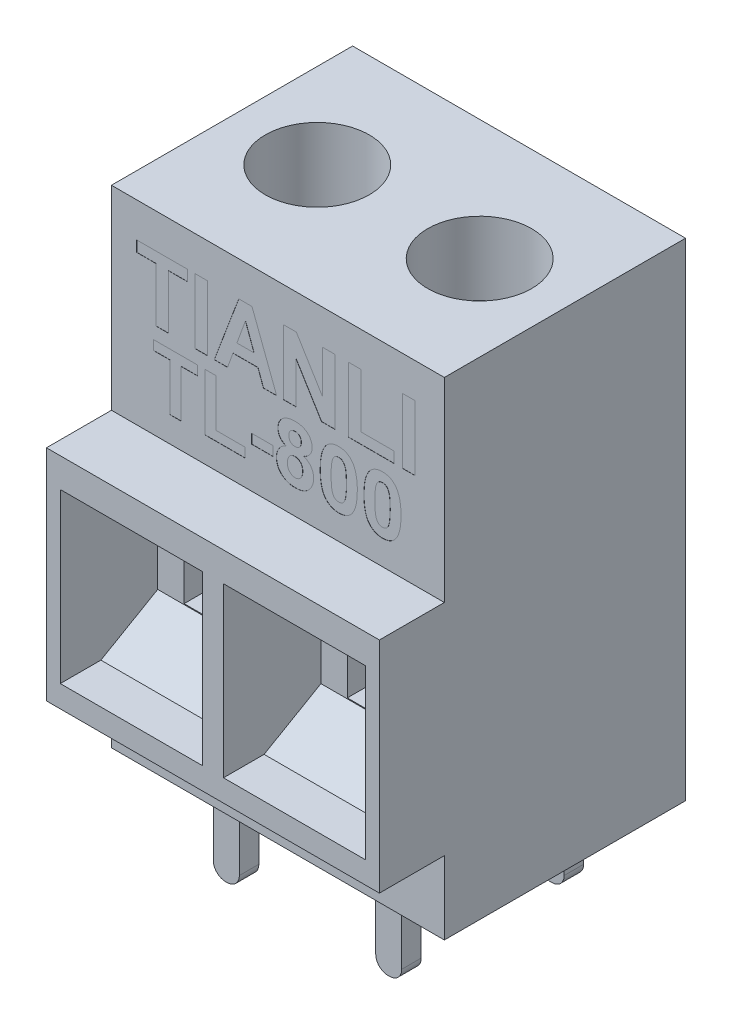
from build123d import *
from OCP.BRepFilletAPI import BRepFilletAPI_MakeChamfer

# Parameters (mm, degrees)
BOSS_EXTRUDE1_DEPTH     = 10.25
SKETCH2_W               = 8.75
SKETCH2_H               = 10.35
CUT_EXTRUDE1_DEPTH      = 6
SKETCH4_W               = 5.5
SKETCH4_H               = 6.2
CUT_EXTRUDE2_DEPTH      = 6
CHAMFER1_SIZE           = 3.5
CHAMFER1_SIZE2          = 2.020725942
SKETCH5_R               = 3.2
CUT_EXTRUDE3_DEPTH      = 4.5
SKETCH6_W               = 4.444559532
SKETCH6_H               = 1
SKETCH6_W_2             = 1
SKETCH6_H_2             = 3.5
CUT_EXTRUDE_THIN1_DEPTH = 1.5
SKETCH7_W               = 1.6
SKETCH7_H               = 1.2
BOSS_EXTRUDE2_DEPTH     = 5.45
FILLET1_R               = 0.75
SKETCH8_W               = 0.76923077
SKETCH8_H               = 4
SKETCH8_W_2             = 0.769230769
SKETCH8_W_3             = 1.301282051
SKETCH8_H_2             = 0.583333333
CUT_EXTRUDE4_DEPTH      = 0.01


with BuildPart() as part:
    # Sketch1 → Boss-Extrude1 (new, symmetric)
    with BuildSketch(Plane(origin=(0, 0, 0), x_dir=(0, 0, -1), z_dir=(1, 0, 0))):
        Polygon((7.425, 15), (-7.425, 15), (-7.425, 3), (-11.425, 3), (-11.425, -10.5), (-7.425, -10.5), (-7.425, -15), (7.425, -15), align=None)
    extrude(amount=BOSS_EXTRUDE1_DEPTH, both=True)

    # Sketch2 → Cut-Extrude1 (cut)
    with BuildSketch(Plane.XY.offset(11.425)):
        with Locations((5.025, -3.975)):
            Rectangle(SKETCH2_W, SKETCH2_H)
        with Locations((-5.025, -3.975)):
            Rectangle(SKETCH2_W, SKETCH2_H)
    extrude(amount=-CUT_EXTRUDE1_DEPTH, mode=Mode.SUBTRACT)

    # Sketch4 → Cut-Extrude2 (cut)
    with BuildSketch(Plane.XY.offset(5.425)):
        with Locations((-5.025, -3.975)):
            Rectangle(SKETCH4_W, SKETCH4_H)
        with Locations((5.025, -3.975)):
            Rectangle(SKETCH4_W, SKETCH4_H)
    extrude(amount=-CUT_EXTRUDE2_DEPTH, mode=Mode.SUBTRACT)

    # Chamfer1: one chamfer whose edges measure the first distance from different faces: ONE call of the kernel's chamfer builder (chamfer() names one face for all edges)
    chamfer1_edges_1 = [part.edges().sort_by_distance(p)[0] for p in [
        (-5.025, -9.15, 5.425),
    ]]
    chamfer1_side_1 = [part.faces().sort_by_distance(p)[0] for p in [
        (-5.025, -9.15, 8.425),
    ]]
    chamfer1_edges_2 = [part.edges().sort_by_distance(p)[0] for p in [
        (-5.025, 1.2, 5.425),
    ]]
    chamfer1_side_2 = [part.faces().sort_by_distance(p)[0] for p in [
        (-5.025, 1.2, 8.425),
    ]]
    chamfer1_edges_3 = [part.edges().sort_by_distance(p)[0] for p in [
        (5.025, -9.15, 5.425),
    ]]
    chamfer1_side_3 = [part.faces().sort_by_distance(p)[0] for p in [
        (5.025, -9.15, 8.425),
    ]]
    chamfer1_edges_4 = [part.edges().sort_by_distance(p)[0] for p in [
        (5.025, 1.2, 5.425),
    ]]
    chamfer1_side_4 = [part.faces().sort_by_distance(p)[0] for p in [
        (5.025, 1.2, 8.425),
    ]]
    chamfer1 = BRepFilletAPI_MakeChamfer(part.part.solid().wrapped)
    for e in chamfer1_edges_1:
        chamfer1.Add(CHAMFER1_SIZE, CHAMFER1_SIZE2, e.wrapped, chamfer1_side_1[0].wrapped)  # the first distance lies on this face
    for e in chamfer1_edges_2:
        chamfer1.Add(CHAMFER1_SIZE, CHAMFER1_SIZE2, e.wrapped, chamfer1_side_2[0].wrapped)  # the first distance lies on this face
    for e in chamfer1_edges_3:
        chamfer1.Add(CHAMFER1_SIZE, CHAMFER1_SIZE2, e.wrapped, chamfer1_side_3[0].wrapped)  # the first distance lies on this face
    for e in chamfer1_edges_4:
        chamfer1.Add(CHAMFER1_SIZE, CHAMFER1_SIZE2, e.wrapped, chamfer1_side_4[0].wrapped)  # the first distance lies on this face
    add(Compound.cast(chamfer1.Shape()), mode=Mode.REPLACE)

    # Sketch5 → Cut-Extrude3 (cut)
    with BuildSketch(Plane(origin=(0, 15, 0), x_dir=(1, 0, 0), z_dir=(0, 1, 0))):
        with Locations(Location((-5, 0, 0), (0, 0, 270))):
            Circle(SKETCH5_R)
        with Locations(Location((5, 0, 0), (0, 0, 90))):
            Circle(SKETCH5_R)
    extrude(amount=-CUT_EXTRUDE3_DEPTH, mode=Mode.SUBTRACT)

    # Sketch6 → Cut-Extrude-Thin1 (cut)
    with BuildSketch(Plane(origin=(0, 10.5, 0), x_dir=(1, 0, 0), z_dir=(0, 1, 0))):
        with Locations((-5, 0)):
            Rectangle(SKETCH6_W, SKETCH6_H)
        with Locations((-5, 0)):
            Rectangle(SKETCH6_W_2, SKETCH6_H_2)
        with Locations((5, 0)):
            Rectangle(SKETCH6_W_2, SKETCH6_H_2)
        with Locations((5, 0)):
            Rectangle(SKETCH6_W, SKETCH6_H)
    extrude(amount=-CUT_EXTRUDE_THIN1_DEPTH, mode=Mode.SUBTRACT)

    # Sketch7 → Boss-Extrude2 (add)
    with BuildSketch(Plane.XZ.offset(15)):
        with Locations((-5, 5)):
            Rectangle(SKETCH7_W, SKETCH7_H)
        with Locations((5, 5)):
            Rectangle(SKETCH7_W, SKETCH7_H)
        with Locations((-5, -5)):
            Rectangle(SKETCH7_W, SKETCH7_H)
        with Locations((5, -5)):
            Rectangle(SKETCH7_W, SKETCH7_H)
    extrude(amount=BOSS_EXTRUDE2_DEPTH)

    # Fillet1
    fillet1_edges = [part.edges().sort_by_distance(p)[0] for p in [
        (-4.2, -20.45, 5),
        (-5.8, -20.45, 5),
        (5.8, -20.45, 5),
        (4.2, -20.45, 5),
        (-4.2, -20.45, -5),
        (-5.8, -20.45, -5),
        (4.2, -20.45, -5),
        (5.8, -20.45, -5),
    ]]
    fillet(fillet1_edges, radius=FILLET1_R)

    # Sketch8 → Cut-Extrude4 (cut)
    # profile 1 of 12: a face of its own
    with BuildSketch(Plane.XY.offset(7.425)):
        Polygon((-7.512820513, 8.861293986), (-7.512820513, 12.194627319), (-8.692307692, 12.194627319), (-8.692307692, 12.861293986), (-5.564102564, 12.861293986), (-5.564102564, 12.194627319), (-6.743589744, 12.194627319), (-6.743589744, 8.861293986), align=None)
    # profile 2 of 12: a face of its own
    with BuildSketch(Plane.XY.offset(7.425)):
        with Locations((-4.717948718, 10.861293986)):
            Rectangle(SKETCH8_W, SKETCH8_H)
    # profile 3 of 12: a face of its own
    with BuildSketch(Plane.XY.offset(7.425)):
        Polygon((-0.076923077, 8.861293986), (-0.892628205, 8.861293986), (-1.229967949, 9.784370909), (-2.765224359, 9.784370909), (-3.102564103, 8.861293986), (-3.923076923, 8.861293986), (-2.411057692, 12.861293986), (-1.596153846, 12.861293986), align=None)
        Polygon((-1.474358974, 10.451037576), (-2, 11.886935012), (-2.524038462, 10.451037576), align=None, mode=Mode.SUBTRACT)
    # profile 4 of 12: a face of its own
    with BuildSketch(Plane.XY.offset(7.425)):
        Polygon((0.333333333, 8.861293986), (0.333333333, 12.861293986), (1.137019231, 12.861293986), (2.743589744, 10.231486294), (2.743589744, 12.861293986), (3.512820513, 12.861293986), (3.512820513, 8.861293986), (2.684294872, 8.861293986), (1.102564103, 11.449435012), (1.102564103, 8.861293986), align=None)
    # profile 5 of 12: a face of its own
    with BuildSketch(Plane.XY.offset(7.425)):
        Polygon((4.333333333, 8.861293986), (4.333333333, 12.861293986), (5.102564103, 12.861293986), (5.102564103, 9.527960653), (7.153846154, 9.527960653), (7.153846154, 8.861293986), align=None)
    # profile 6 of 12: a face of its own
    with BuildSketch(Plane.XY.offset(7.425)):
        with Locations((8.051282052, 10.861293986)):
            Rectangle(SKETCH8_W_2, SKETCH8_H)
    # profile 7 of 12: a face of its own
    with BuildSketch(Plane.XY.offset(7.425)):
        Polygon((-6.641025641, 4.564745346), (-6.641025641, 7.481412013), (-7.673076923, 7.481412013), (-7.673076923, 8.064745346), (-4.935897436, 8.064745346), (-4.935897436, 7.481412013), (-5.967948718, 7.481412013), (-5.967948718, 4.564745346), align=None)
    # profile 8 of 12: a face of its own
    with BuildSketch(Plane.XY.offset(7.425)):
        Polygon((-4.487179487, 4.564745346), (-4.487179487, 8.064745346), (-3.814102564, 8.064745346), (-3.814102564, 5.14807868), (-2.019230769, 5.14807868), (-2.019230769, 4.564745346), align=None)
    # profile 9 of 12: a face of its own
    with BuildSketch(Plane.XY.offset(7.425)):
        with Locations((-0.96474359, 5.798719705)):
            Rectangle(SKETCH8_W_3, SKETCH8_H_2)
    # profile 10 of 12: a face of its own
    with BuildSketch(Plane.XY.offset(7.425)):
        with BuildLine():
            add(Edge.make_bspline(
                [(0.505508814, 6.467589898), (0.484108403, 6.476651492), (0.442102019, 6.494438289), (0.382460985, 6.525535645), (0.327170175, 6.558701255), (0.277098211, 6.59525645), (0.230170324, 6.632557978), (0.189165573, 6.674408494), (0.151660805, 6.717636029), (0.108878396, 6.778603764), (0.065235353, 6.859081875), (0.027728374, 6.961355467), (0.004414915, 7.068340181), (0.001484224, 7.141484222), (0, 7.178527398)],
                knots=[0, 0, 0, 0, 0.898135024, 1.762928937, 2.598141881, 3.387992021, 4.158483993, 4.912374357, 5.649344587, 6.368826796, 7.78793972, 9.174346042, 10.568971657, 12, 12, 12, 12], degree=3))
            add(Edge.make_bspline(
                [(0, 7.178527398), (0.000794324, 7.209883646), (0.002354104, 7.271456563), (0.015052406, 7.361780572), (0.037092733, 7.447908544), (0.067024117, 7.530084069), (0.105968392, 7.607868176), (0.153525204, 7.681185276), (0.208814476, 7.751060563), (0.273687797, 7.8152257), (0.345689766, 7.874508393), (0.425821831, 7.925594708), (0.513225967, 7.968513765), (0.607403672, 8.004630911), (0.709306049, 8.031323985), (0.818012205, 8.051268479), (0.93390967, 8.062075882), (1.013567998, 8.063839437), (1.054487179, 8.064745346)],
                knots=[0, 0, 0, 0, 0.969401132, 1.903571386, 2.813295953, 3.714164367, 4.602979607, 5.497068024, 6.412430398, 7.352730811, 8.313282239, 9.291613189, 10.283859467, 11.320059661, 12.405231593, 13.536450991, 14.734515125, 16, 16, 16, 16], degree=3))
            add(Edge.make_bspline(
                [(1.054487179, 8.064745346), (1.095175168, 8.063857122), (1.174139354, 8.062133324), (1.289304373, 8.051112407), (1.397154582, 8.031549594), (1.498481383, 8.004401323), (1.592361957, 7.968310955), (1.680140287, 7.926034105), (1.759924081, 7.874050908), (1.832494647, 7.815292758), (1.898034509, 7.75106985), (1.953981151, 7.681183548), (2.002393932, 7.60807055), (2.041194259, 7.530057944), (2.071253709, 7.447924084), (2.092986737, 7.361711699), (2.106863059, 7.271525634), (2.108262218, 7.209895664), (2.108974359, 7.178527398)],
                knots=[0, 0, 0, 0, 1.259437241, 2.444221022, 3.576496957, 4.648717845, 5.68588583, 6.685544666, 7.658705287, 8.625770615, 9.572078176, 10.492824823, 11.391686538, 12.281331915, 13.183041723, 14.093615956, 15.029693465, 16, 16, 16, 16], degree=3))
            add(Edge.make_bspline(
                [(2.108974359, 7.178527398), (2.107438833, 7.139582302), (2.104417221, 7.062946027), (2.07806347, 6.951824743), (2.036587193, 6.846867631), (1.977022876, 6.750332445), (1.903280867, 6.661923124), (1.814179219, 6.585333091), (1.712646687, 6.518269782), (1.637210264, 6.484759896), (1.598557692, 6.467589898)],
                knots=[0, 0, 0, 0, 1.001685467, 1.971119642, 2.924446479, 3.896772127, 4.879289176, 5.877460772, 6.912440485, 8, 8, 8, 8], degree=3))
            add(Edge.make_bspline(
                [(1.598557692, 6.467589898), (1.622551724, 6.457652114), (1.6696341, 6.438151662), (1.736541113, 6.403444108), (1.798855918, 6.365426657), (1.857675401, 6.32511941), (1.910743328, 6.279790233), (1.960004265, 6.232087998), (2.005463682, 6.181348936), (2.045678623, 6.126899753), (2.081666206, 6.069663528), (2.11324535, 6.01054457), (2.139276996, 5.948680689), (2.160948834, 5.885225403), (2.178087393, 5.819398926), (2.189509769, 5.751339299), (2.197945057, 5.681140544), (2.198458268, 5.633514977), (2.198717949, 5.609416821)],
                knots=[0, 0, 0, 0, 1.114643742, 2.187213659, 3.231772812, 4.247796845, 5.244764516, 6.224002375, 7.19061506, 8.165938012, 9.126385546, 10.091434554, 11.040068535, 12.004700134, 12.968444139, 13.956586669, 14.966049226, 16, 16, 16, 16], degree=3))
            add(Edge.make_bspline(
                [(2.198717949, 5.609416821), (2.197719664, 5.570118436), (2.195758173, 5.492902529), (2.181998389, 5.37983852), (2.157145773, 5.272647891), (2.12323776, 5.171061405), (2.080955843, 5.074351961), (2.026830988, 4.984390815), (1.964224565, 4.89956236), (1.892143942, 4.821455091), (1.812332422, 4.750691643), (1.725834459, 4.688503658), (1.63249613, 4.636576264), (1.533084848, 4.593266483), (1.426862764, 4.560845715), (1.314573609, 4.536688374), (1.195996187, 4.52277893), (1.11481921, 4.520854862), (1.073417468, 4.519873552)],
                knots=[0, 0, 0, 0, 1.069671731, 2.10175744, 3.09402022, 4.059639235, 5.013663234, 5.960662081, 6.911094837, 7.879078902, 8.847982309, 9.810095429, 10.772776236, 11.750101161, 12.756155452, 13.790512928, 14.873121219, 16, 16, 16, 16], degree=3))
            add(Edge.make_bspline(
                [(1.073417468, 4.519873552), (1.034597226, 4.520770406), (0.958662864, 4.522524698), (0.847028445, 4.533674014), (0.740570552, 4.553196746), (0.638879236, 4.58084052), (0.541825947, 4.615356932), (0.450617855, 4.659626106), (0.363246148, 4.709582851), (0.309960809, 4.749944182), (0.283253205, 4.770174032)],
                knots=[0, 0, 0, 0, 1.102600357, 2.156742264, 3.182669202, 4.172953404, 5.147246686, 6.10327948, 7.049328352, 8, 8, 8, 8], degree=3))
            add(Edge.make_bspline(
                [(0.283253205, 4.770174032), (0.253338031, 4.795142658), (0.19428384, 4.844432092), (0.11901138, 4.930186132), (0.05395269, 5.021492989), (0.001361065, 5.120036697), (-0.039666087, 5.225762655), (-0.068786506, 5.337973729), (-0.086942647, 5.457149987), (-0.088793453, 5.53877004), (-0.08974359, 5.580670827)],
                knots=[0, 0, 0, 0, 1.009349607, 1.992511403, 2.949479119, 3.912246635, 4.881480856, 5.884237694, 6.913844069, 8, 8, 8, 8], degree=3))
            add(Edge.make_bspline(
                [(-0.08974359, 5.580670827), (-0.087977136, 5.627070679), (-0.084485744, 5.718779857), (-0.057040851, 5.853402627), (-0.011727374, 5.981809766), (0.040044572, 6.083451901), (0.091032965, 6.159725119), (0.134899725, 6.214165172), (0.184008604, 6.265200512), (0.237975107, 6.313066457), (0.297612752, 6.356749234), (0.362236364, 6.397124474), (0.431371092, 6.435488691), (0.480539322, 6.456778252), (0.505508814, 6.467589898)],
                knots=[0, 0, 0, 0, 1.466730477, 2.898988729, 4.325053486, 5.763136659, 6.492982434, 7.22372602, 7.971323195, 8.73066801, 9.502396106, 10.306304791, 11.139877329, 12, 12, 12, 12], degree=3))
        make_face()
        with BuildLine():
            add(Edge.make_bspline(
                [(0.673076923, 7.125943263), (0.674112516, 7.095679409), (0.676095978, 7.037715305), (0.695883879, 6.956035983), (0.728635779, 6.884689602), (0.773688539, 6.824204433), (0.830816132, 6.776586406), (0.897121406, 6.742481937), (0.972253521, 6.722469123), (1.024915565, 6.719920729), (1.052383814, 6.7185915)],
                knots=[0, 0, 0, 0, 1.15281608, 2.207978909, 3.181172827, 4.129718639, 5.059990565, 5.992992319, 6.953155196, 8, 8, 8, 8], degree=3))
            add(Edge.make_bspline(
                [(1.052383814, 6.7185915), (1.080097238, 6.719875088), (1.133528459, 6.722349832), (1.209240254, 6.743091825), (1.276402828, 6.777368253), (1.333615976, 6.825597286), (1.379821791, 6.886134253), (1.41293287, 6.957627658), (1.433002389, 7.039558876), (1.43489943, 7.097542344), (1.435897436, 7.128046629)],
                knots=[0, 0, 0, 0, 1.048069097, 2.020667378, 2.946900928, 3.882892544, 4.829907216, 5.807806237, 6.846717784, 8, 8, 8, 8], degree=3))
            add(Edge.make_bspline(
                [(1.435897436, 7.128046629), (1.434905319, 7.156932385), (1.433007885, 7.212176705), (1.412503017, 7.29033367), (1.380352924, 7.360021795), (1.334086941, 7.418805906), (1.278567052, 7.467773042), (1.212402503, 7.501428183), (1.138280261, 7.52266458), (1.085958423, 7.525043941), (1.05869391, 7.526283808)],
                knots=[0, 0, 0, 0, 1.120059371, 2.14212559, 3.117108277, 4.081714894, 5.028368956, 5.970787798, 6.942592912, 8, 8, 8, 8], degree=3))
            add(Edge.make_bspline(
                [(1.05869391, 7.526283808), (1.030509428, 7.525033183), (0.976602895, 7.522641198), (0.900122314, 7.50173721), (0.832606142, 7.466980736), (0.775768876, 7.417933044), (0.729501841, 7.358408334), (0.696137583, 7.288944236), (0.67611445, 7.210250428), (0.674117042, 7.154811958), (0.673076923, 7.125943263)],
                knots=[0, 0, 0, 0, 1.078082589, 2.061974896, 3.011033917, 3.963675658, 4.914590949, 5.879605178, 6.895838403, 8, 8, 8, 8], degree=3))
        make_face(mode=Mode.SUBTRACT)
        with BuildLine():
            add(Edge.make_bspline(
                [(0.583333333, 5.644472911), (0.583702502, 5.622019166), (0.584419323, 5.578420367), (0.590960264, 5.514938606), (0.601045151, 5.45499348), (0.616812761, 5.399136098), (0.635396635, 5.346449839), (0.659504456, 5.298344316), (0.686880221, 5.253336342), (0.719196008, 5.212872976), (0.754797654, 5.176889356), (0.792135275, 5.144571152), (0.832191537, 5.118225172), (0.874038296, 5.095916213), (0.918371537, 5.079114208), (0.964778866, 5.06758085), (1.013044882, 5.059047444), (1.046034073, 5.058576085), (1.062900641, 5.05833509)],
                knots=[0, 0, 0, 0, 1.266244622, 2.458687606, 3.596609786, 4.690452447, 5.728949622, 6.743059962, 7.719893583, 8.695837149, 9.65607124, 10.572687906, 11.475837526, 12.354503287, 13.243297811, 14.141816854, 15.049956288, 16, 16, 16, 16], degree=3))
            add(Edge.make_bspline(
                [(1.062900641, 5.05833509), (1.07928637, 5.058662136), (1.111283498, 5.059300774), (1.158322028, 5.066598956), (1.203093294, 5.078639209), (1.246159745, 5.094452248), (1.286339819, 5.115967832), (1.324649951, 5.141503517), (1.361184748, 5.171473769), (1.394639198, 5.206855532), (1.425803227, 5.245884879), (1.452249707, 5.289959163), (1.475862541, 5.337526709), (1.493381849, 5.389865736), (1.508876621, 5.445627287), (1.517770819, 5.505906887), (1.524620996, 5.569997432), (1.525294344, 5.614069546), (1.525641026, 5.636760571)],
                knots=[0, 0, 0, 0, 0.942317584, 1.840104704, 2.730710625, 3.607499931, 4.473808274, 5.346669015, 6.254175223, 7.186360584, 8.144194921, 9.122212144, 10.13877185, 11.193666142, 12.293061794, 13.46493029, 14.694790812, 16, 16, 16, 16], degree=3))
            add(Edge.make_bspline(
                [(1.525641026, 5.636760571), (1.525254928, 5.656642889), (1.524498867, 5.695576621), (1.518055821, 5.752557472), (1.507602495, 5.806740353), (1.49305582, 5.857990481), (1.473951945, 5.905753674), (1.451309804, 5.950788323), (1.424128991, 5.992721931), (1.392363184, 6.03103012), (1.358419335, 6.066100813), (1.321469698, 6.096608976), (1.282290265, 6.122589968), (1.240670109, 6.143831887), (1.19678822, 6.15985185), (1.151078587, 6.171945258), (1.102860841, 6.179149747), (1.069936562, 6.17979811), (1.053084936, 6.180129962)],
                knots=[0, 0, 0, 0, 1.18097333, 2.312592441, 3.401847494, 4.45657129, 5.472467779, 6.453609222, 7.447247299, 8.433973197, 9.406033457, 10.342947316, 11.274909381, 12.193955836, 13.112162788, 14.045055317, 14.999401151, 16, 16, 16, 16], degree=3))
            add(Edge.make_bspline(
                [(1.053084936, 6.180129962), (1.033897588, 6.179561277), (0.996762882, 6.17846066), (0.942834369, 6.17083334), (0.892835803, 6.157302124), (0.846153853, 6.139379223), (0.803502765, 6.115126488), (0.764882819, 6.085359205), (0.729471501, 6.051007054), (0.688955949, 5.998194641), (0.646630049, 5.927177997), (0.610886966, 5.835851566), (0.586927403, 5.741521383), (0.584533073, 5.676868755), (0.583333333, 5.644472911)],
                knots=[0, 0, 0, 0, 0.864439711, 1.673014741, 2.446909759, 3.19383146, 3.919980361, 4.648644137, 5.385779273, 6.135663785, 7.641703236, 9.092511638, 10.543128981, 12, 12, 12, 12], degree=3))
        make_face(mode=Mode.SUBTRACT)
    # profile 11 of 12: a face of its own
    with BuildSketch(Plane.XY.offset(7.425)):
        with BuildLine():
            add(Edge.make_bspline(
                [(3.746794872, 8.064745346), (3.788456533, 8.063740494), (3.869567011, 8.061784162), (3.98775391, 8.044454601), (4.099032757, 8.016667616), (4.203395386, 7.977388743), (4.300744027, 7.926382857), (4.39043024, 7.863431988), (4.474413789, 7.790423154), (4.52291122, 7.733767089), (4.547475962, 7.705069866)],
                knots=[0, 0, 0, 0, 1.098584764, 2.138818609, 3.143716932, 4.11936356, 5.073598562, 6.034819447, 7.004603936, 8, 8, 8, 8], degree=3))
            add(Edge.make_bspline(
                [(4.547475962, 7.705069866), (4.561527386, 7.686793526), (4.590203881, 7.649494718), (4.628824673, 7.589223966), (4.665953311, 7.525289992), (4.698362987, 7.456153883), (4.729396658, 7.383015379), (4.758156045, 7.30570783), (4.783126925, 7.223592495), (4.806623063, 7.137719359), (4.825770261, 7.046747292), (4.843464042, 6.951658394), (4.858132983, 6.852021581), (4.869700308, 6.748155637), (4.880031075, 6.640218589), (4.885691835, 6.527695373), (4.890326792, 6.410837242), (4.890790011, 6.331343835), (4.891025641, 6.290907205)],
                knots=[0, 0, 0, 0, 0.746761706, 1.524009783, 2.317797294, 3.140957436, 3.996208027, 4.892396322, 5.812273159, 6.776774596, 7.776522781, 8.823794876, 9.910947555, 11.039215469, 12.21036455, 13.424061321, 14.689674014, 16, 16, 16, 16], degree=3))
            add(Edge.make_bspline(
                [(4.891025641, 6.290907205), (4.89079356, 6.250470483), (4.890338659, 6.171210463), (4.885674556, 6.054586773), (4.880026029, 5.942298163), (4.869724408, 5.83435535), (4.858046331, 5.730510054), (4.843796784, 5.630984931), (4.82477152, 5.536332969), (4.805925531, 5.445505996), (4.782567142, 5.359267237), (4.756474117, 5.27729916), (4.728870643, 5.199027899), (4.697115437, 5.125795241), (4.663542892, 5.056573578), (4.626966798, 4.991987021), (4.587914771, 4.931342746), (4.558960849, 4.893847166), (4.544671474, 4.875342302)],
                knots=[0, 0, 0, 0, 1.308387162, 2.564569672, 3.776470597, 4.945886788, 6.07248526, 7.158029334, 8.197718558, 9.195987466, 10.159061779, 11.087054987, 11.979325145, 12.84323098, 13.668471539, 14.467659354, 15.243757377, 16, 16, 16, 16], degree=3))
            add(Edge.make_bspline(
                [(4.544671474, 4.875342302), (4.520331485, 4.846891055), (4.472283171, 4.790726921), (4.389229122, 4.718323557), (4.299691589, 4.656674595), (4.202514412, 4.606682328), (4.098661735, 4.567132426), (3.987200783, 4.540232125), (3.869336759, 4.522867284), (3.788224796, 4.520885696), (3.746794872, 4.519873552)],
                knots=[0, 0, 0, 0, 0.991631672, 1.957528776, 2.911425699, 3.867574088, 4.848108326, 5.850523106, 6.902101959, 8, 8, 8, 8], degree=3))
            add(Edge.make_bspline(
                [(3.746794872, 4.519873552), (3.704891418, 4.521079309), (3.622779428, 4.523442053), (3.502892364, 4.542172196), (3.388934207, 4.57217777), (3.281314065, 4.615017729), (3.180185923, 4.670535173), (3.084759728, 4.737085278), (2.997111567, 4.817681451), (2.928492621, 4.892712042), (2.878290793, 4.960507699), (2.842883757, 5.016726283), (2.80866663, 5.076882412), (2.779133137, 5.142856868), (2.749995722, 5.212698325), (2.724189129, 5.287911962), (2.701421028, 5.367851015), (2.68004323, 5.452150458), (2.662217296, 5.541390952), (2.645820053, 5.635309143), (2.632898142, 5.734304442), (2.621441536, 5.837825458), (2.613375429, 5.946116564), (2.606824722, 6.059000546), (2.603539994, 6.176838743), (2.602893755, 6.257018133), (2.602564103, 6.297918423)],
                knots=[0, 0, 0, 0, 1.257818097, 2.464759732, 3.634271214, 4.790227596, 5.933394726, 7.09190477, 8.274482889, 9.50191983, 10.139172818, 10.805000628, 11.49619854, 12.215266328, 12.973768034, 13.768328009, 14.601232062, 15.469317089, 16.379095881, 17.333267023, 18.331755967, 19.376479622, 20.460535752, 21.592206075, 22.771760786, 24, 24, 24, 24], degree=3))
            add(Edge.make_bspline(
                [(2.602564103, 6.297918423), (2.60279433, 6.338121598), (2.603245546, 6.416914652), (2.607943662, 6.533068671), (2.613517543, 6.644896196), (2.62393129, 6.752592957), (2.635445574, 6.855994824), (2.649959143, 6.955238123), (2.668511381, 7.049809386), (2.688710751, 7.140086066), (2.71086808, 7.226387875), (2.737203674, 7.307993425), (2.764531254, 7.386136958), (2.796657613, 7.458978992), (2.830024042, 7.528054966), (2.866628757, 7.592629419), (2.90567358, 7.653276741), (2.934628434, 7.690771927), (2.948918269, 7.709276596)],
                knots=[0, 0, 0, 0, 1.304469132, 2.556591843, 3.77188756, 4.93702727, 6.066781583, 7.147865049, 8.190466662, 9.19316792, 10.149665317, 11.080258032, 11.975027628, 12.834388201, 13.661940433, 14.463366943, 15.241638981, 16, 16, 16, 16], degree=3))
            add(Edge.make_bspline(
                [(2.948918269, 7.709276596), (2.97325692, 7.73773058), (3.021302592, 7.793900117), (3.104375985, 7.866263927), (3.19401251, 7.928178993), (3.291474082, 7.977572877), (3.395088686, 8.01766499), (3.50640377, 8.044350631), (3.624249015, 8.061761303), (3.705363605, 8.063736478), (3.746794872, 8.064745346)],
                knots=[0, 0, 0, 0, 0.991667276, 1.957599061, 2.911530233, 3.873218945, 4.847995157, 5.850445929, 6.902062539, 8, 8, 8, 8], degree=3))
        make_face()
        with BuildLine():
            add(Edge.make_bspline(
                [(3.746794872, 7.481412013), (3.725452438, 7.480434019), (3.683235155, 7.478499458), (3.621873273, 7.464162481), (3.563922037, 7.440503343), (3.509102083, 7.407475494), (3.458624795, 7.361529211), (3.415866009, 7.29992511), (3.378938616, 7.224326659), (3.360458483, 7.167819935), (3.350661058, 7.137862334)],
                knots=[0, 0, 0, 0, 0.899391665, 1.779078861, 2.640979247, 3.529945348, 4.464599804, 5.495588918, 6.672261578, 8, 8, 8, 8], degree=3))
            add(Edge.make_bspline(
                [(3.350661058, 7.137862334), (3.344542397, 7.115258495), (3.331391774, 7.066676862), (3.316466364, 6.987468612), (3.304157686, 6.897575632), (3.293764252, 6.797018814), (3.285306186, 6.685744947), (3.280097418, 6.563683227), (3.276497212, 6.430919183), (3.275934016, 6.338819924), (3.275641026, 6.290907205)],
                knots=[0, 0, 0, 0, 0.658986521, 1.416336438, 2.266694271, 3.212608458, 4.261595115, 5.407496572, 6.651304179, 8, 8, 8, 8], degree=3))
            add(Edge.make_bspline(
                [(3.275641026, 6.290907205), (3.276040466, 6.243231511), (3.276806127, 6.151845201), (3.278980348, 6.020677789), (3.285151914, 5.901278479), (3.291329055, 5.793171452), (3.301617356, 5.696697341), (3.311965247, 5.611595637), (3.326228113, 5.538447547), (3.345688969, 5.458885851), (3.375121019, 5.375611914), (3.415500913, 5.291600731), (3.458801971, 5.224143686), (3.509802853, 5.175844893), (3.565000751, 5.143444877), (3.622252038, 5.119638883), (3.683558042, 5.106280485), (3.725467058, 5.104243515), (3.746794872, 5.103206885)],
                knots=[0, 0, 0, 0, 1.613353868, 3.092528792, 4.438413522, 5.658843895, 6.755779493, 7.721003256, 8.558527904, 9.275869043, 10.491421475, 11.538327284, 12.426656321, 13.187490948, 13.890032692, 14.581719216, 15.278226227, 16, 16, 16, 16], degree=3))
            add(Edge.make_bspline(
                [(3.746794872, 5.103206885), (3.768382753, 5.104135276), (3.810629413, 5.105952102), (3.872071689, 5.120767106), (3.930105438, 5.143714835), (3.984558578, 5.177416082), (4.034988589, 5.223047761), (4.077716161, 5.284707221), (4.114653425, 5.360288165), (4.133132056, 5.416797552), (4.142928686, 5.446756564)],
                knots=[0, 0, 0, 0, 0.909107913, 1.77908945, 2.650019014, 3.530482969, 4.465025013, 5.495890128, 6.672421267, 8, 8, 8, 8], degree=3))
            add(Edge.make_bspline(
                [(4.142928686, 5.446756564), (4.149038496, 5.469362197), (4.162110234, 5.517726206), (4.177141999, 5.596441365), (4.189484001, 5.685868523), (4.199778615, 5.785967907), (4.208319876, 5.897001413), (4.213484428, 6.01883292), (4.217088021, 6.151362552), (4.217654638, 6.243228161), (4.217948718, 6.290907205)],
                knots=[0, 0, 0, 0, 0.66114423, 1.414496391, 2.261103113, 3.210114492, 4.255954433, 5.405607896, 6.653488082, 8, 8, 8, 8], degree=3))
            add(Edge.make_bspline(
                [(4.217948718, 6.290907205), (4.217981234, 6.338587892), (4.218043567, 6.429990969), (4.213913777, 6.561324873), (4.209860748, 6.68107589), (4.201595932, 6.789009435), (4.193317991, 6.885490029), (4.180985913, 6.970034625), (4.168562316, 7.04357506), (4.147330358, 7.12297096), (4.118475955, 7.206484211), (4.079055383, 7.291368365), (4.034494512, 7.358193069), (3.983863286, 7.407312575), (3.928937075, 7.440424748), (3.871545285, 7.464302981), (3.810344022, 7.478475811), (3.768133757, 7.480426079), (3.746794872, 7.481412013)],
                knots=[0, 0, 0, 0, 1.611146624, 3.088541111, 4.440175916, 5.659517762, 6.746360572, 7.711365618, 8.546319149, 9.264661039, 10.486047304, 11.528122518, 12.419721574, 13.184982167, 13.89070983, 14.574167459, 15.279187713, 16, 16, 16, 16], degree=3))
        make_face(mode=Mode.SUBTRACT)
    # profile 12 of 12: a face of its own
    with BuildSketch(Plane.XY.offset(7.425)):
        with BuildLine():
            add(Edge.make_bspline(
                [(6.439102564, 8.064745346), (6.480764225, 8.063740494), (6.561874704, 8.061784162), (6.680061602, 8.044454601), (6.791340449, 8.016667616), (6.895703078, 7.977388743), (6.993051719, 7.926382857), (7.082737932, 7.863431988), (7.166721482, 7.790423154), (7.215218913, 7.733767089), (7.239783654, 7.705069866)],
                knots=[0, 0, 0, 0, 1.098584764, 2.138818609, 3.143716932, 4.11936356, 5.073598562, 6.034819447, 7.004603936, 8, 8, 8, 8], degree=3))
            add(Edge.make_bspline(
                [(7.239783654, 7.705069866), (7.253835078, 7.686793526), (7.282511573, 7.649494718), (7.321132366, 7.589223966), (7.358261003, 7.525289992), (7.39067068, 7.456153883), (7.42170435, 7.383015379), (7.450463737, 7.30570783), (7.475434618, 7.223592495), (7.498930756, 7.137719359), (7.518077953, 7.046747292), (7.535771734, 6.951658394), (7.550440675, 6.852021581), (7.562008, 6.748155637), (7.572338767, 6.640218589), (7.577999528, 6.527695373), (7.582634484, 6.410837242), (7.583097703, 6.331343835), (7.583333333, 6.290907205)],
                knots=[0, 0, 0, 0, 0.746761706, 1.524009783, 2.317797294, 3.140957436, 3.996208027, 4.892396322, 5.812273159, 6.776774596, 7.776522781, 8.823794876, 9.910947555, 11.039215469, 12.21036455, 13.424061321, 14.689674014, 16, 16, 16, 16], degree=3))
            add(Edge.make_bspline(
                [(7.583333333, 6.290907205), (7.583101253, 6.250470483), (7.582646351, 6.171210463), (7.577982248, 6.054586773), (7.572333721, 5.942298163), (7.562032101, 5.83435535), (7.550354024, 5.730510054), (7.536104476, 5.630984931), (7.517079212, 5.536332969), (7.498233223, 5.445505996), (7.474874835, 5.359267237), (7.448781809, 5.27729916), (7.421178336, 5.199027899), (7.38942313, 5.125795241), (7.355850585, 5.056573578), (7.31927449, 4.991987021), (7.280222464, 4.931342746), (7.251268542, 4.893847166), (7.236979167, 4.875342302)],
                knots=[0, 0, 0, 0, 1.308387162, 2.564569672, 3.776470597, 4.945886788, 6.07248526, 7.158029334, 8.197718558, 9.195987466, 10.159061779, 11.087054987, 11.979325145, 12.84323098, 13.668471539, 14.467659354, 15.243757377, 16, 16, 16, 16], degree=3))
            add(Edge.make_bspline(
                [(7.236979167, 4.875342302), (7.212639177, 4.846891055), (7.164590863, 4.790726921), (7.081536814, 4.718323557), (6.991999281, 4.656674595), (6.894822105, 4.606682328), (6.790969427, 4.567132426), (6.679508476, 4.540232125), (6.561644451, 4.522867284), (6.480532488, 4.520885696), (6.439102564, 4.519873552)],
                knots=[0, 0, 0, 0, 0.991631672, 1.957528776, 2.911425699, 3.867574088, 4.848108326, 5.850523106, 6.902101959, 8, 8, 8, 8], degree=3))
            add(Edge.make_bspline(
                [(6.439102564, 4.519873552), (6.39719911, 4.521079309), (6.315087121, 4.523442053), (6.195200056, 4.542172196), (6.0812419, 4.57217777), (5.973621758, 4.615017729), (5.872493615, 4.670535173), (5.777067421, 4.737085278), (5.689419259, 4.817681451), (5.620800313, 4.892712042), (5.570598485, 4.960507699), (5.535191449, 5.016726283), (5.500974323, 5.076882412), (5.471440829, 5.142856868), (5.442303414, 5.212698325), (5.416496821, 5.287911962), (5.39372872, 5.367851015), (5.372350922, 5.452150458), (5.354524988, 5.541390952), (5.338127745, 5.635309143), (5.325205834, 5.734304442), (5.313749228, 5.837825458), (5.305683122, 5.946116564), (5.299132414, 6.059000546), (5.295847686, 6.176838743), (5.295201447, 6.257018133), (5.294871795, 6.297918423)],
                knots=[0, 0, 0, 0, 1.257818097, 2.464759732, 3.634271214, 4.790227596, 5.933394726, 7.09190477, 8.274482889, 9.50191983, 10.139172818, 10.805000628, 11.49619854, 12.215266328, 12.973768034, 13.768328009, 14.601232062, 15.469317089, 16.379095881, 17.333267023, 18.331755967, 19.376479622, 20.460535752, 21.592206075, 22.771760786, 24, 24, 24, 24], degree=3))
            add(Edge.make_bspline(
                [(5.294871795, 6.297918423), (5.295102022, 6.338121598), (5.295553239, 6.416914652), (5.300251354, 6.533068671), (5.305825235, 6.644896196), (5.316238982, 6.752592957), (5.327753267, 6.855994824), (5.342266836, 6.955238123), (5.360819073, 7.049809386), (5.381018444, 7.140086066), (5.403175773, 7.226387875), (5.429511366, 7.307993425), (5.456838947, 7.386136958), (5.488965305, 7.458978992), (5.522331734, 7.528054966), (5.55893645, 7.592629419), (5.597981272, 7.653276741), (5.626936127, 7.690771927), (5.641225962, 7.709276596)],
                knots=[0, 0, 0, 0, 1.304469132, 2.556591843, 3.77188756, 4.93702727, 6.066781583, 7.147865049, 8.190466662, 9.19316792, 10.149665317, 11.080258032, 11.975027628, 12.834388201, 13.661940433, 14.463366943, 15.241638981, 16, 16, 16, 16], degree=3))
            add(Edge.make_bspline(
                [(5.641225962, 7.709276596), (5.665564612, 7.73773058), (5.713610284, 7.793900117), (5.796683677, 7.866263927), (5.886320202, 7.928178993), (5.983781775, 7.977572877), (6.087396378, 8.01766499), (6.198711462, 8.044350631), (6.316556707, 8.061761303), (6.397671298, 8.063736478), (6.439102564, 8.064745346)],
                knots=[0, 0, 0, 0, 0.991667276, 1.957599061, 2.911530233, 3.873218945, 4.847995157, 5.850445929, 6.902062539, 8, 8, 8, 8], degree=3))
        make_face()
        with BuildLine():
            add(Edge.make_bspline(
                [(6.439102564, 7.481412013), (6.41776013, 7.480434019), (6.375542847, 7.478499458), (6.314180965, 7.464162481), (6.256229729, 7.440503343), (6.201409776, 7.407475494), (6.150932487, 7.361529211), (6.108173701, 7.29992511), (6.071246308, 7.224326659), (6.052766176, 7.167819935), (6.04296875, 7.137862334)],
                knots=[0, 0, 0, 0, 0.899391665, 1.779078861, 2.640979247, 3.529945348, 4.464599804, 5.495588918, 6.672261578, 8, 8, 8, 8], degree=3))
            add(Edge.make_bspline(
                [(6.04296875, 7.137862334), (6.036850089, 7.115258495), (6.023699467, 7.066676862), (6.008774057, 6.987468612), (5.996465379, 6.897575632), (5.986071944, 6.797018814), (5.977613878, 6.685744947), (5.97240511, 6.563683227), (5.968804905, 6.430919183), (5.968241709, 6.338819924), (5.967948718, 6.290907205)],
                knots=[0, 0, 0, 0, 0.658986521, 1.416336438, 2.266694271, 3.212608458, 4.261595115, 5.407496572, 6.651304179, 8, 8, 8, 8], degree=3))
            add(Edge.make_bspline(
                [(5.967948718, 6.290907205), (5.968348158, 6.243231511), (5.969113819, 6.151845201), (5.971288041, 6.020677789), (5.977459606, 5.901278479), (5.983636747, 5.793171452), (5.993925048, 5.696697341), (6.004272939, 5.611595637), (6.018535805, 5.538447547), (6.037996662, 5.458885851), (6.067428711, 5.375611914), (6.107808605, 5.291600731), (6.151109663, 5.224143686), (6.202110546, 5.175844893), (6.257308444, 5.143444877), (6.31455973, 5.119638883), (6.375865734, 5.106280485), (6.41777475, 5.104243515), (6.439102564, 5.103206885)],
                knots=[0, 0, 0, 0, 1.613353868, 3.092528792, 4.438413522, 5.658843895, 6.755779493, 7.721003256, 8.558527904, 9.275869043, 10.491421475, 11.538327284, 12.426656321, 13.187490948, 13.890032692, 14.581719216, 15.278226227, 16, 16, 16, 16], degree=3))
            add(Edge.make_bspline(
                [(6.439102564, 5.103206885), (6.460690446, 5.104135276), (6.502937105, 5.105952102), (6.564379382, 5.120767106), (6.62241313, 5.143714835), (6.676866271, 5.177416082), (6.727296282, 5.223047761), (6.770023853, 5.284707221), (6.806961117, 5.360288165), (6.825439748, 5.416797552), (6.835236378, 5.446756564)],
                knots=[0, 0, 0, 0, 0.909107913, 1.77908945, 2.650019014, 3.530482969, 4.465025013, 5.495890128, 6.672421267, 8, 8, 8, 8], degree=3))
            add(Edge.make_bspline(
                [(6.835236378, 5.446756564), (6.841346188, 5.469362197), (6.854417926, 5.517726206), (6.869449692, 5.596441365), (6.881791693, 5.685868523), (6.892086308, 5.785967907), (6.900627569, 5.897001413), (6.90579212, 6.01883292), (6.909395713, 6.151362552), (6.909962331, 6.243228161), (6.91025641, 6.290907205)],
                knots=[0, 0, 0, 0, 0.66114423, 1.414496391, 2.261103113, 3.210114492, 4.255954433, 5.405607896, 6.653488082, 8, 8, 8, 8], degree=3))
            add(Edge.make_bspline(
                [(6.91025641, 6.290907205), (6.910288926, 6.338587892), (6.910351259, 6.429990969), (6.906221469, 6.561324873), (6.902168441, 6.68107589), (6.893903625, 6.789009435), (6.885625683, 6.885490029), (6.873293605, 6.970034625), (6.860870008, 7.04357506), (6.839638051, 7.12297096), (6.810783648, 7.206484211), (6.771363076, 7.291368365), (6.726802205, 7.358193069), (6.676170979, 7.407312575), (6.621244767, 7.440424748), (6.563852978, 7.464302981), (6.502651714, 7.478475811), (6.46044145, 7.480426079), (6.439102564, 7.481412013)],
                knots=[0, 0, 0, 0, 1.611146624, 3.088541111, 4.440175916, 5.659517762, 6.746360572, 7.711365618, 8.546319149, 9.264661039, 10.486047304, 11.528122518, 12.419721574, 13.184982167, 13.89070983, 14.574167459, 15.279187713, 16, 16, 16, 16], degree=3))
        make_face(mode=Mode.SUBTRACT)
    extrude(amount=-CUT_EXTRUDE4_DEPTH, mode=Mode.SUBTRACT)


solid = part.part
